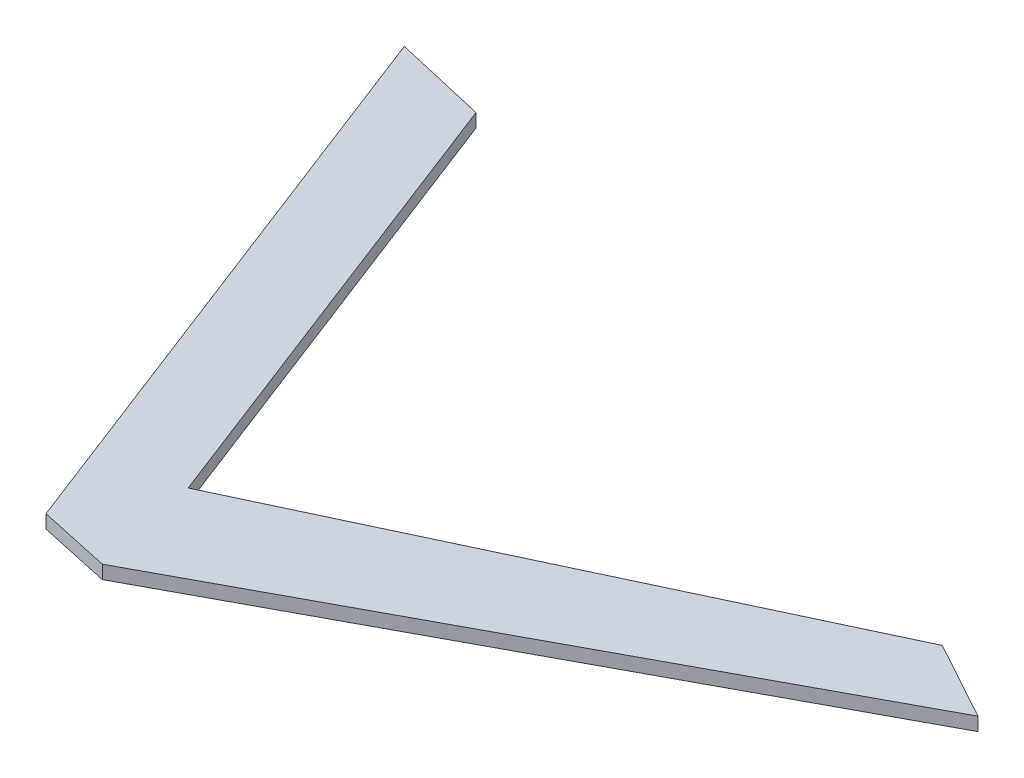
from build123d import *

# Parameters (mm, degrees)
BOSS_EXTRUDE1_DEPTH = 1


with BuildPart() as part:
    # Sketch1 → Boss-Extrude1 (new body)
    with BuildSketch(Plane(origin=(0, 0, 0), x_dir=(1, 0, 0), z_dir=(0, 1, 0))):
        Polygon((0, 0), (-13.548347494, 35.074239552), (-20.516167381, 36.677980809), (-3.652798692, -6.978253527), (1.722307926, -8.143684282), (44.307352531, 14.752526671), (38.389721758, 17.999701757), align=None)
    extrude(amount=BOSS_EXTRUDE1_DEPTH)


solid = part.part
